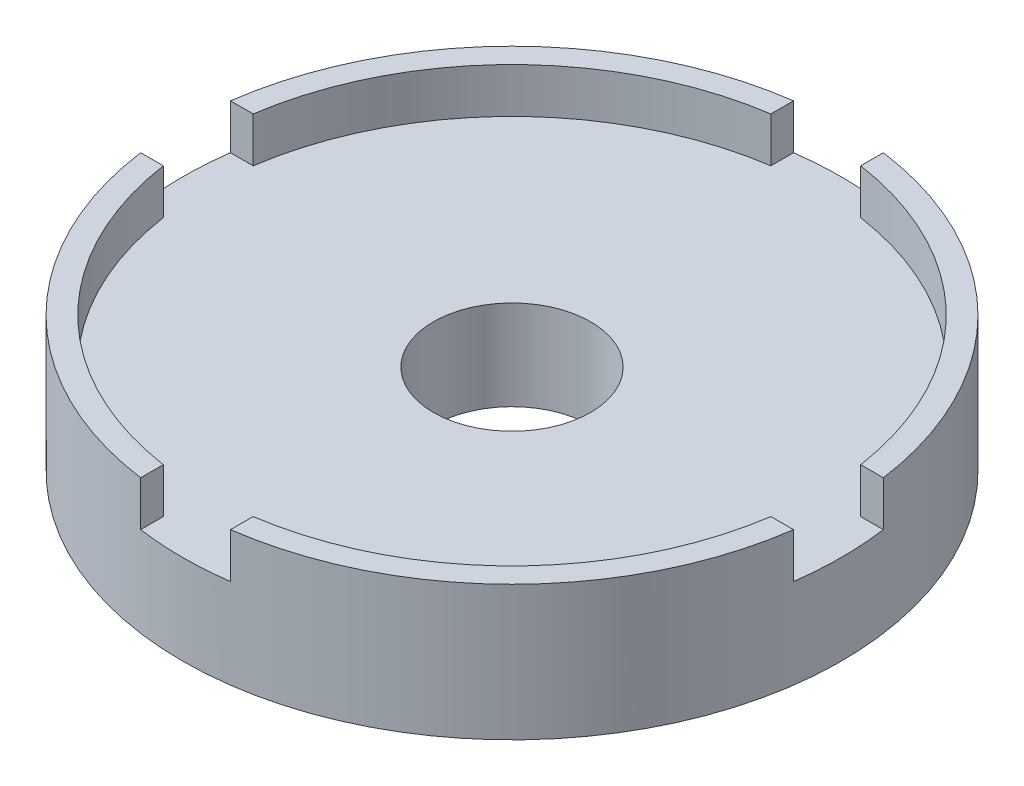
from build123d import *

# Parameters (mm, degrees)
SKETCH1_R                = 68.354
SKETCH1_R_2              = 17.5
BOSS_EXTRUDE2_DEPTH      = 20
BOSS_EXTRUDE3_DEPTH      = 10
BOSS_EXTRUDE3_DEPTH_BACK = 20
SKETCH2_R                = 73.354
SKETCH2_R_2              = 68.354
CUT_EXTRUDE1_DEPTH       = 114.995028009
CUT_EXTRUDE1_DEPTH_BACK  = 114.995028009
CUT_EXTRUDE2_DEPTH       = 114.995028009
CUT_EXTRUDE2_DEPTH_BACK  = 114.995028009


with BuildPart() as part:
    # Sketch1 → Boss-Extrude2 (new body)
    with BuildSketch(Plane(origin=(0, 0, 0), x_dir=(1, 0, 0), z_dir=(0, 1, 0))):
        with Locations(Location((4.002282363, -4.818066557, 0), (0, 0, 270))):
            Circle(SKETCH1_R)
        with Locations(Location((4.002282363, -4.818066557, 0), (0, 0, 270))):
            Circle(SKETCH1_R_2, mode=Mode.SUBTRACT)
    extrude(amount=BOSS_EXTRUDE2_DEPTH)

    # Sketch2 → Boss-Extrude3 (add, two sides: drawn at the far end of the back side and taken through both)
    with BuildSketch(Plane(origin=(0, 20, 0), x_dir=(1, 0, 0), z_dir=(0, 1, 0)).offset(-BOSS_EXTRUDE3_DEPTH_BACK)):
        with Locations(Location((4.002282363, -4.818066557, 0), (0, 0, 270))):
            Circle(SKETCH2_R)
        with Locations(Location((4.002282363, -4.818066557, 0), (0, 0, 270))):
            Circle(SKETCH2_R_2, mode=Mode.SUBTRACT)
    extrude(amount=BOSS_EXTRUDE3_DEPTH + BOSS_EXTRUDE3_DEPTH_BACK)

    # Sketch3 → Cut-Extrude1 (cut, two sides: drawn at the far end of the back side and taken through both)
    with BuildSketch(Plane(origin=(0, 0, 0), x_dir=(0, 0, -1), z_dir=(1, 0, 0)).offset(-CUT_EXTRUDE1_DEPTH_BACK)):
        Polygon((-4.818066557, 30), (5.181933443, 30), (5.181933443, 20), (-14.818066557, 20), (-14.818066557, 30), align=None)
    extrude(amount=CUT_EXTRUDE1_DEPTH + CUT_EXTRUDE1_DEPTH_BACK, mode=Mode.SUBTRACT)

    # Sketch5 → Cut-Extrude2 (cut, two sides: drawn at the far end of the back side and taken through both)
    with BuildSketch(Plane.XY.offset(-CUT_EXTRUDE2_DEPTH_BACK)):
        Polygon((4.002282363, 30), (14.002282363, 30), (14.002282363, 20), (-5.997717637, 20), (-5.997717637, 30), align=None)
    extrude(amount=CUT_EXTRUDE2_DEPTH + CUT_EXTRUDE2_DEPTH_BACK, mode=Mode.SUBTRACT)


solid = part.part
